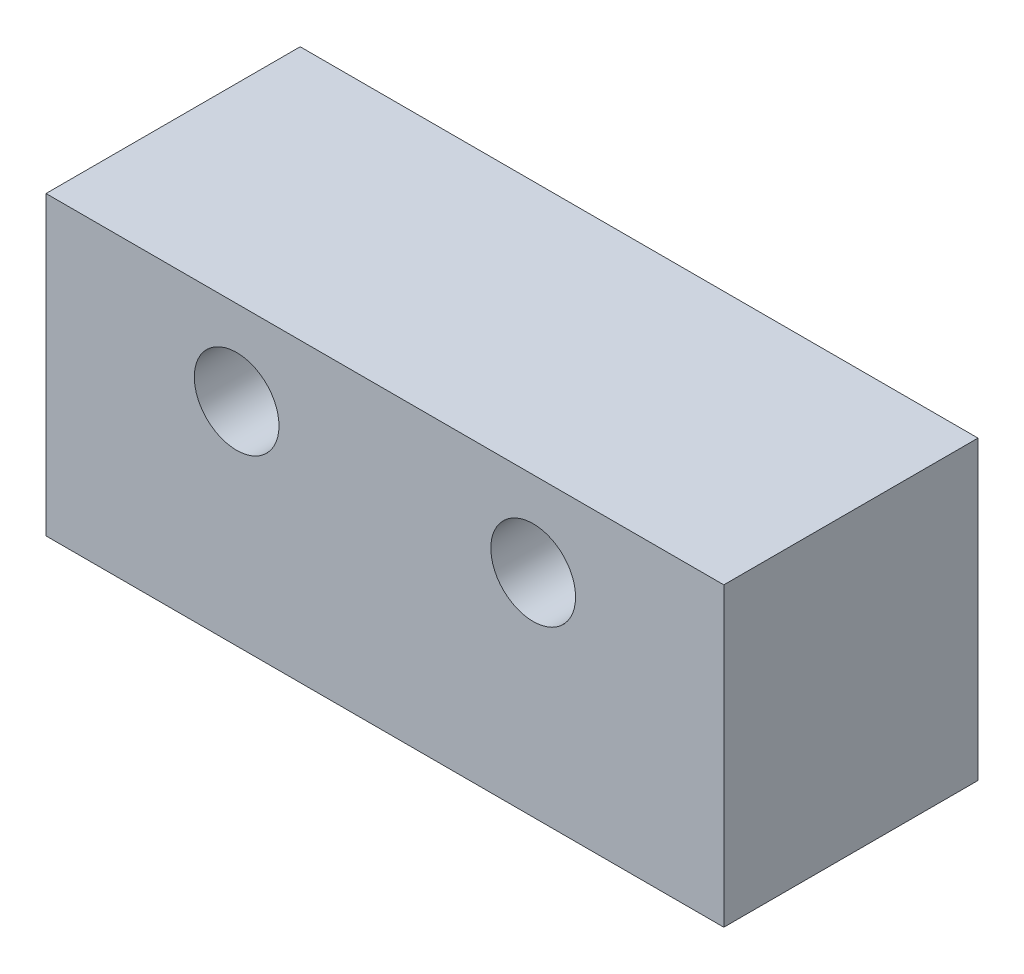
from build123d import *

# Parameters (mm, degrees)
SKETCH_1_W          = 16
SKETCH_1_H          = 10
EXTRUDE_1_DEPTH     = 3
SKETCH_2_R          = 2
CUT_EXTRUDE_1_DEPTH = 5
SKETCH_4_R          = 1
CUT_EXTRUDE_2_DEPTH = 10
SKETCH_5_W          = 20.147345776
SKETCH_5_H          = 7.992609138
CUT_EXTRUDE_3_DEPTH = 3


with BuildPart() as part:
    # 스케치1 → 보스-돌출1 (new, symmetric)
    with BuildSketch(Plane.XY):
        Rectangle(SKETCH_1_W, SKETCH_1_H)
    extrude(amount=EXTRUDE_1_DEPTH, both=True)

    # 스케치2 → 컷-돌출1 (cut)
    with BuildSketch(Plane.XZ.offset(5)):
        with Locations(Location((0, 0, 0), (0, 0, 270))):
            Circle(SKETCH_2_R)
    extrude(amount=-CUT_EXTRUDE_1_DEPTH, mode=Mode.SUBTRACT)

    # 스케치4 → 컷-돌출2 (cut)
    with BuildSketch(Plane.XY.offset(3)):
        with Locations((-3.5, 0)):
            Circle(SKETCH_4_R)
        with Locations((3.5, 0)):
            Circle(SKETCH_4_R)
    extrude(amount=-CUT_EXTRUDE_2_DEPTH, mode=Mode.SUBTRACT)

    # 스케치5 → 컷-돌출3 (cut)
    with BuildSketch(Plane(origin=(0, 5, 0), x_dir=(1, 0, 0), z_dir=(0, 1, 0))):
        Rectangle(SKETCH_5_W, SKETCH_5_H)
    extrude(amount=-CUT_EXTRUDE_3_DEPTH, mode=Mode.SUBTRACT)


solid = part.part
